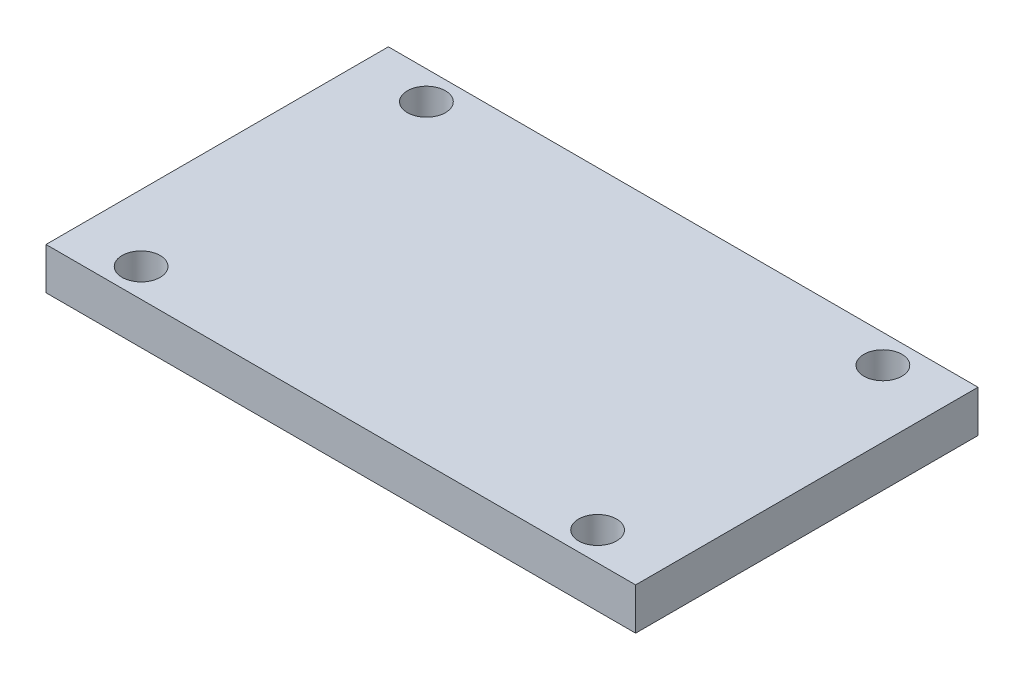
from build123d import *

# Parameters (mm, degrees)
SKETCH_1_W          = 155
SKETCH_1_H          = 90
EXTRUDE_1_DEPTH     = 11
SKETCH_2_R          = 5
CUT_EXTRUDE_1_DEPTH = 91.289811164


with BuildPart() as part:
    # 草图1 → 凸台-拉伸1 (new body)
    with BuildSketch(Plane(origin=(0, 0, 0), x_dir=(1, 0, 0), z_dir=(0, 1, 0))):
        Rectangle(SKETCH_1_W, SKETCH_1_H)
    extrude(amount=EXTRUDE_1_DEPTH)

    # 草图2 → 切除-拉伸1 (cut, through all)
    with BuildSketch(Plane.XZ):
        with Locations(Location((60, -37.5, 0), (0, 0, 270))):
            Circle(SKETCH_2_R)
        with Locations(Location((60, 37.5, 0), (0, 0, 270))):
            Circle(SKETCH_2_R)
        with Locations(Location((-60, 37.5, 0), (0, 0, 270))):
            Circle(SKETCH_2_R)
        with Locations(Location((-60, -37.5, 0), (0, 0, 270))):
            Circle(SKETCH_2_R)
    extrude(amount=-CUT_EXTRUDE_1_DEPTH, mode=Mode.SUBTRACT)


solid = part.part
